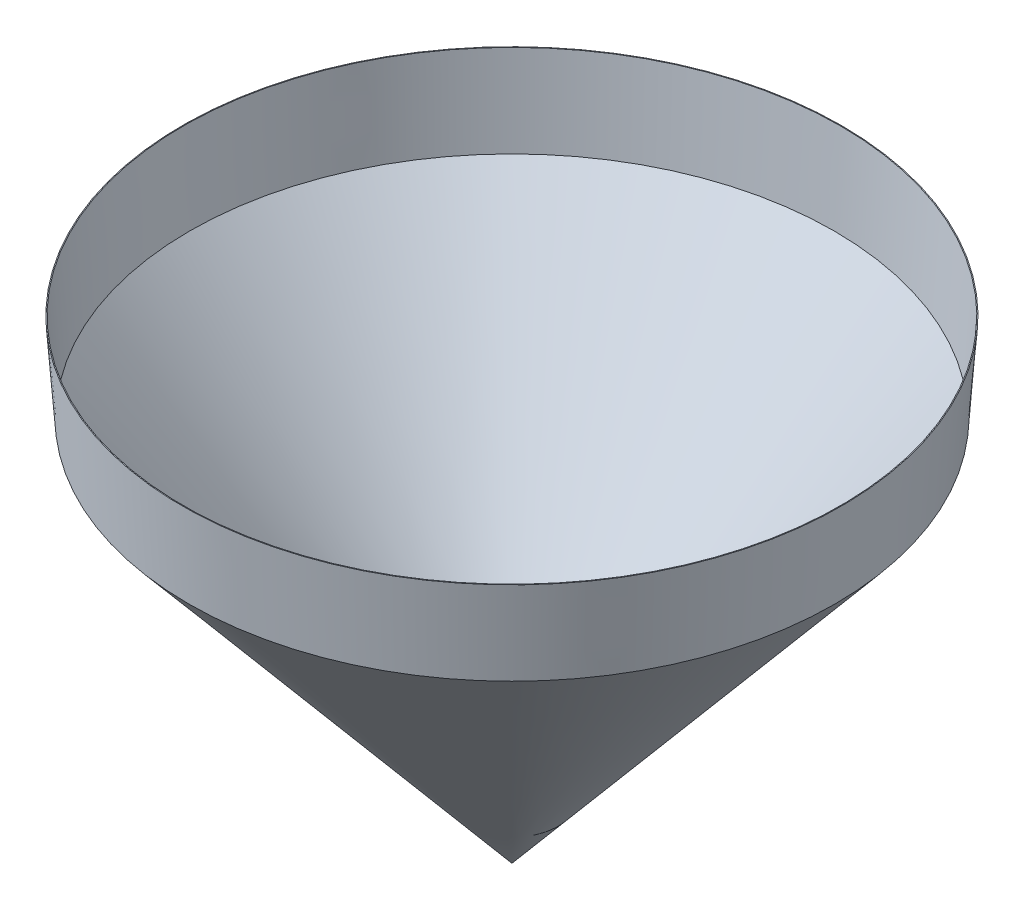
from build123d import *

# Parameters (mm, degrees)
SHELL1_T = -0.1


with BuildPart() as part:
    # Sketch2 → Revolve1 (revolve)
    with BuildSketch(Plane(origin=(0, 0, 0), x_dir=(0, 0, -1), z_dir=(1, 0, 0)), mode=Mode.PRIVATE) as revolve1_sk:
        Polygon((-39.219962532, 56.427283979), (-38.451575394, 45.949277561), (0, 0), (0, 56.427283979), align=None)
    revolve(revolve1_sk.sketch.rotate(Axis((0, 0, 0), (0, 1, 0)), 180), axis=Axis((0, 0, 0), (0, 1, 0)))

    # Shell1
    shell1_openings = [part.faces().sort_by_distance(p)[0] for p in [
        (0, 56.427283979, 0),
    ]]
    offset(amount=SHELL1_T, openings=shell1_openings, kind=Kind.INTERSECTION)


solid = part.part
